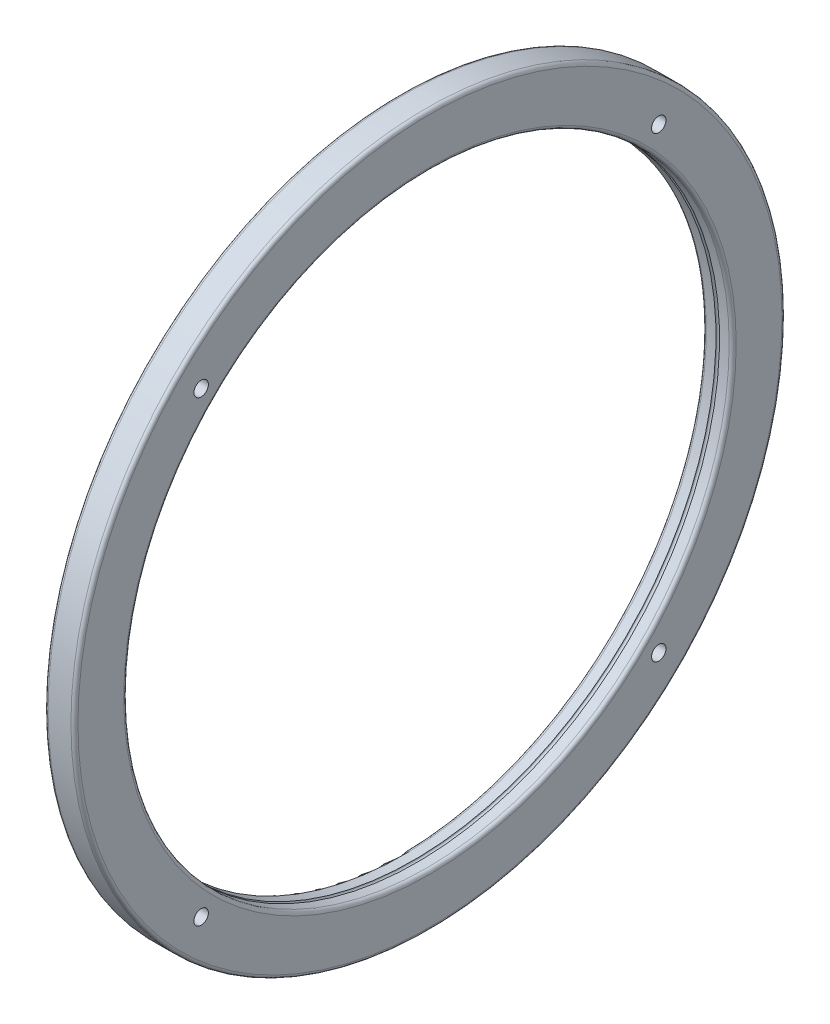
from build123d import *

# Parameters (mm, degrees)
FILLET1_R          = 1
CUT_EXTRUDE1_REACH = 145.088
SKETCH3_R          = 2.05


with BuildPart() as part:
    # Sketch1 → Revolve1 (revolve)
    with BuildSketch(Plane(origin=(0, 0, 0), x_dir=(1, 0, 0), z_dir=(0, 1, 0)), mode=Mode.PRIVATE) as revolve1_sk:
        with BuildLine():
            Line((-4.25, 101), (4.25, 101))
            Line((4.25, 101), (4.25, 86))
            Line((4.25, 86), (0.501586867, 86))
            ThreePointArc((0.501586867, 86), (0.001586867, 86.5), (-0.498413133, 86))
            Line((-0.498413133, 86), (-4.25, 86))
            Line((-4.25, 86), (-4.25, 101))
        make_face()
    revolve(revolve1_sk.sketch.rotate(Axis((0, 0, 0), (1, 0, 0)), 180), axis=Axis((0, 0, 0), (1, 0, 0)))

    # Fillet1
    fillet1_edges = [part.edges().sort_by_distance(p)[0] for p in [
        (-4.25, 0, -86),
        (-4.25, 0, -101),
        (4.25, 0, -101),
        (4.25, 0, -86),
    ]]
    fillet(fillet1_edges, radius=FILLET1_R)

    # Sketch3 → Cut-Extrude1 (cut, up to next)
    with BuildSketch(Plane(origin=(4.25, 0, 0), x_dir=(0, 0, -1), z_dir=(1, 0, 0)), mode=Mode.PRIVATE) as cut_extrude1_sk1:
        with Locations((-65, -65)):
            Circle(SKETCH3_R)
    cut_extrude1_tool1 = extrude(cut_extrude1_sk1.sketch, amount=-CUT_EXTRUDE1_REACH, mode=Mode.PRIVATE) & part.part
    # Sketch3 → Cut-Extrude1 (cut, up to next)
    with BuildSketch(Plane(origin=(4.25, 0, 0), x_dir=(0, 0, -1), z_dir=(1, 0, 0)), mode=Mode.PRIVATE) as cut_extrude1_sk2:
        with Locations((-65, 65)):
            Circle(SKETCH3_R)
    cut_extrude1_tool2 = extrude(cut_extrude1_sk2.sketch, amount=-CUT_EXTRUDE1_REACH, mode=Mode.PRIVATE) & part.part
    # Sketch3 → Cut-Extrude1 (cut, up to next)
    with BuildSketch(Plane(origin=(4.25, 0, 0), x_dir=(0, 0, -1), z_dir=(1, 0, 0)), mode=Mode.PRIVATE) as cut_extrude1_sk3:
        with Locations((65, 65)):
            Circle(SKETCH3_R)
    cut_extrude1_tool3 = extrude(cut_extrude1_sk3.sketch, amount=-CUT_EXTRUDE1_REACH, mode=Mode.PRIVATE) & part.part
    # Sketch3 → Cut-Extrude1 (cut, up to next)
    with BuildSketch(Plane(origin=(4.25, 0, 0), x_dir=(0, 0, -1), z_dir=(1, 0, 0)), mode=Mode.PRIVATE) as cut_extrude1_sk4:
        with Locations((65, -65)):
            Circle(SKETCH3_R)
    cut_extrude1_tool4 = extrude(cut_extrude1_sk4.sketch, amount=-CUT_EXTRUDE1_REACH, mode=Mode.PRIVATE) & part.part
    add(cut_extrude1_tool1.solids().sort_by_distance((4.25, -65, 65))[0], mode=Mode.SUBTRACT)
    add(cut_extrude1_tool2.solids().sort_by_distance((4.25, 65, 65))[0], mode=Mode.SUBTRACT)
    add(cut_extrude1_tool3.solids().sort_by_distance((4.25, 65, -65))[0], mode=Mode.SUBTRACT)
    add(cut_extrude1_tool4.solids().sort_by_distance((4.25, -65, -65))[0], mode=Mode.SUBTRACT)


solid = part.part
